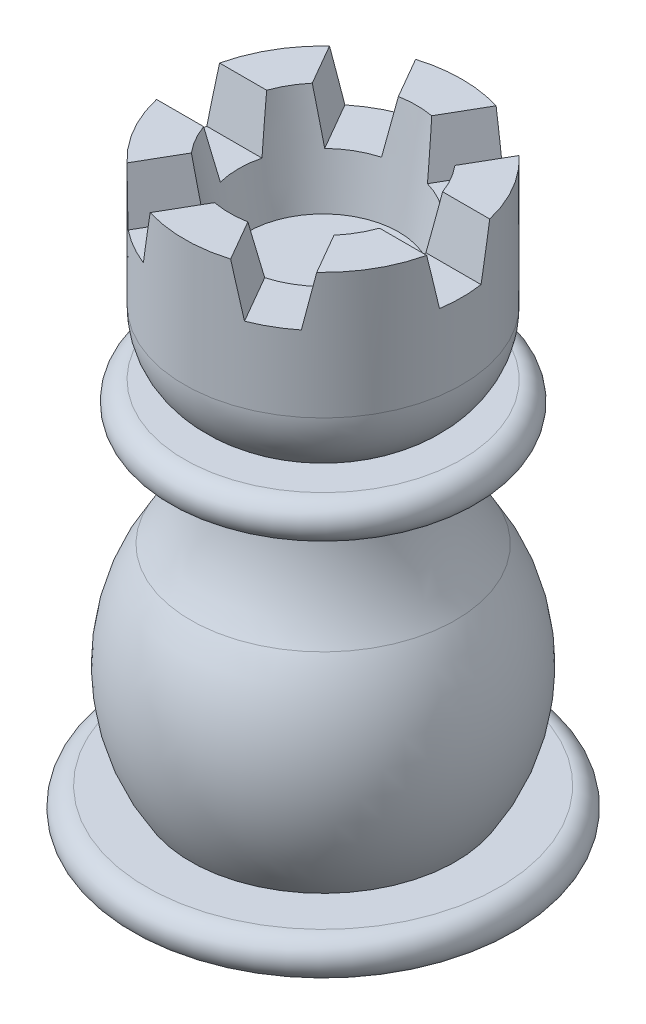
from build123d import *

# Parameters (mm, degrees)
CUT_EXTRUDE1_DEPTH = 51.955863315
CIRPATTERN1_COUNT  = 3


with BuildPart() as part:
    # Sketch1 → Revolve1 (revolve)
    with BuildSketch(Plane(origin=(0, 0, 0), x_dir=(0, 0, -1), z_dir=(1, 0, 0)), mode=Mode.PRIVATE) as revolve1_sk:
        with BuildLine():
            Line((-14, 0), (0, 0))
            Line((0, 0), (0, 38))
            Line((0, 38), (-6, 38))
            Line((-6, 38), (-7.410615846, 46))
            Line((-7.410615846, 46), (-11, 46))
            Line((-11, 46), (-11, 36))
            ThreePointArc((-11, 36), (-10.230529619, 33.060346975), (-8.11948003, 30.874685928))
            Line((-8.11948003, 30.874685928), (-11, 30.874685928))
            ThreePointArc((-11, 30.874685928), (-12.5, 29.374685928), (-11, 27.874685928))
            Line((-11, 27.874685928), (-8, 27.874685928))
            ThreePointArc((-8, 27.874685928), (-8.638593384, 23.544558909), (-10.5, 19.583123952))
            ThreePointArc((-10.5, 19.583123952), (-13, 11.291561976), (-10.5, 3))
            Line((-10.5, 3), (-14, 3))
            ThreePointArc((-14, 3), (-15.5, 1.5), (-14, 0))
        make_face()
    revolve(revolve1_sk.sketch.rotate(Axis((0, 0, 0), (0, 1, 0)), 180), axis=Axis((0, 0, 0), (0, 1, 0)))

    # Sketch2 → Cut-Extrude1 (cut, symmetric)
    with BuildSketch(Plane(origin=(0, 0, 0), x_dir=(0, 0, -1), z_dir=(1, 0, 0))):
        Polygon((1.649773753, 42), (-1.649773753, 42), (-2.5, 46), (2.5, 46), align=None)
    cut_extrude1 = extrude(amount=CUT_EXTRUDE1_DEPTH, both=True, mode=Mode.SUBTRACT)

    # CirPattern1: Cut-Extrude1 ×3 about axis
    cirpattern1_axis = Axis((0, 0, 0), (0, 1, 0))
    for i in range(1, CIRPATTERN1_COUNT):
        add(cut_extrude1.rotate(cirpattern1_axis, i * 360 / CIRPATTERN1_COUNT), mode=Mode.SUBTRACT)


solid = part.part
